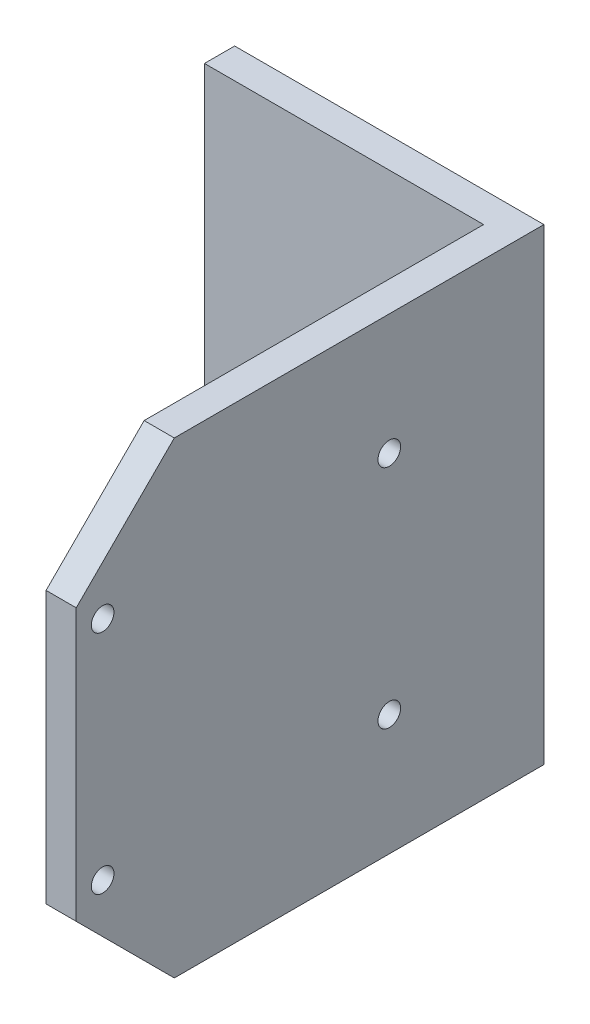
from build123d import *

# Parameters (mm, degrees)
EXTRUDE_1_DEPTH     = 31
SKETCH_2_R          = 1.5
CUT_EXTRUDE_2_DEPTH = 10


with BuildPart() as part:
    # 草图1 → 凸台-拉伸1 (new, symmetric)
    with BuildSketch(Plane(origin=(0, 0, 0), x_dir=(1, 0, 0), z_dir=(0, 1, 0))):
        Polygon((-30.126027397, 43.157534247), (10.873972603, 43.157534247), (10.873972603, -18.842465753), (6.873972603, -18.842465753), (6.873972603, 39.157534247), (-30.126027397, 39.157534247), align=None)
    extrude(amount=EXTRUDE_1_DEPTH, both=True)

    # 草图2 → 切除-拉伸2 (cut)
    with BuildSketch(Plane(origin=(10.873972603, 0, 0), x_dir=(0, 0, -1), z_dir=(1, 0, 0))):
        Polygon((-5.842465753, 31), (-18.842465753, 31), (-18.842465753, 18), align=None)
        with Locations((22.657534247, -15)):
            Circle(SKETCH_2_R)
        Polygon((-5.842465753, -31), (-18.842465753, -18), (-18.842465753, -31), align=None)
        with Locations((22.657534247, 15)):
            Circle(SKETCH_2_R)
        with Locations((-15.342465753, 15)):
            Circle(SKETCH_2_R)
        with Locations((-15.342465753, -15)):
            Circle(SKETCH_2_R)
    extrude(amount=-CUT_EXTRUDE_2_DEPTH, mode=Mode.SUBTRACT)


solid = part.part
